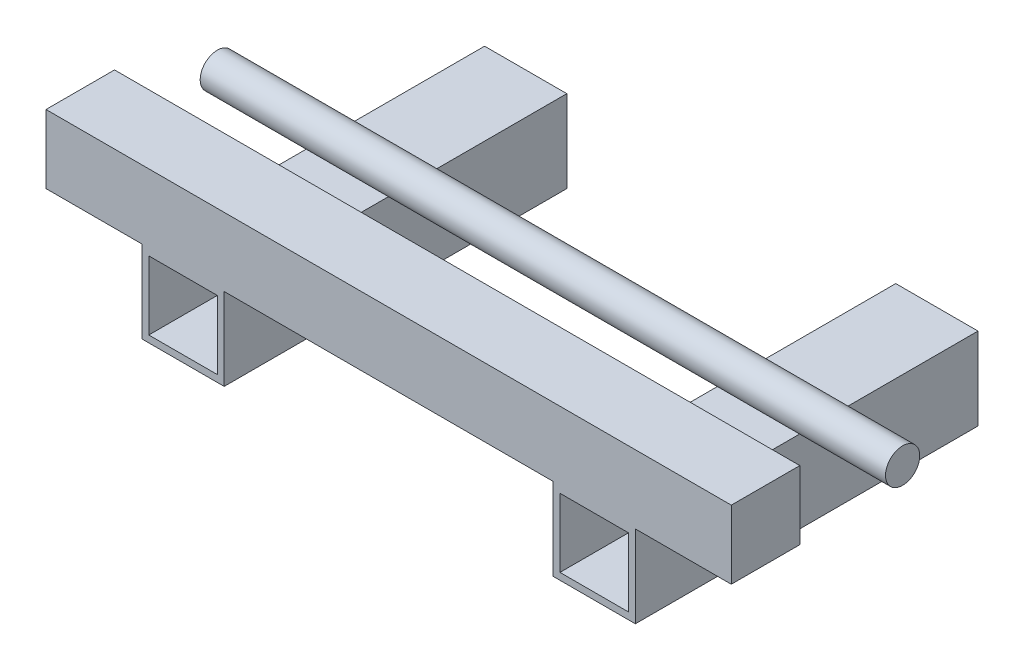
from build123d import *

# Parameters (mm, degrees)
SKETCH1_W             = 12
SKETCH1_H             = 12
SKETCH1_W_2           = 10
SKETCH1_H_2           = 10
BOSS_EXTRUDE1_DEPTH   = 50
BOSS_EXTRUDE1_2_DEPTH = 50
SKETCH2_R             = 2.5
SKETCH2_W             = 10
SKETCH2_H             = 10
BOSS_EXTRUDE2_DEPTH   = 50


with BuildPart() as part:
    # Sketch1 → Boss-Extrude1 (new body)
    with BuildSketch(Plane.XY):
        with Locations((-25.236114275, -1.483415253)):
            Rectangle(SKETCH1_W, SKETCH1_H)
        with Locations((-25.236114275, -1.483415253)):
            Rectangle(SKETCH1_W_2, SKETCH1_H_2, mode=Mode.SUBTRACT)
    extrude(amount=BOSS_EXTRUDE1_DEPTH)



with BuildPart() as body_2:
    # Sketch1 → Boss-Extrude1 2 (new body)
    with BuildSketch(Plane.XY):
        with Locations((34.763885725, -1.483415253)):
            Rectangle(SKETCH1_W, SKETCH1_H)
        with Locations((34.763885725, -1.483415253)):
            Rectangle(SKETCH1_W_2, SKETCH1_H_2, mode=Mode.SUBTRACT)
    extrude(amount=BOSS_EXTRUDE1_2_DEPTH)


with BuildPart() as part_1:
    add(part.part)

    add(body_2.part)  # Boss-Extrude2 merges body 2
    # Sketch2 → Boss-Extrude2 (add, symmetric)
    with BuildSketch(Plane.ZY.offset(-4.763885725)):
        with Locations((25, 7.016584747)):
            Circle(SKETCH2_R)
        with Locations((45, 9.516584747)):
            Rectangle(SKETCH2_W, SKETCH2_H)
    extrude(amount=BOSS_EXTRUDE2_DEPTH, both=True)


solid = part_1.part
